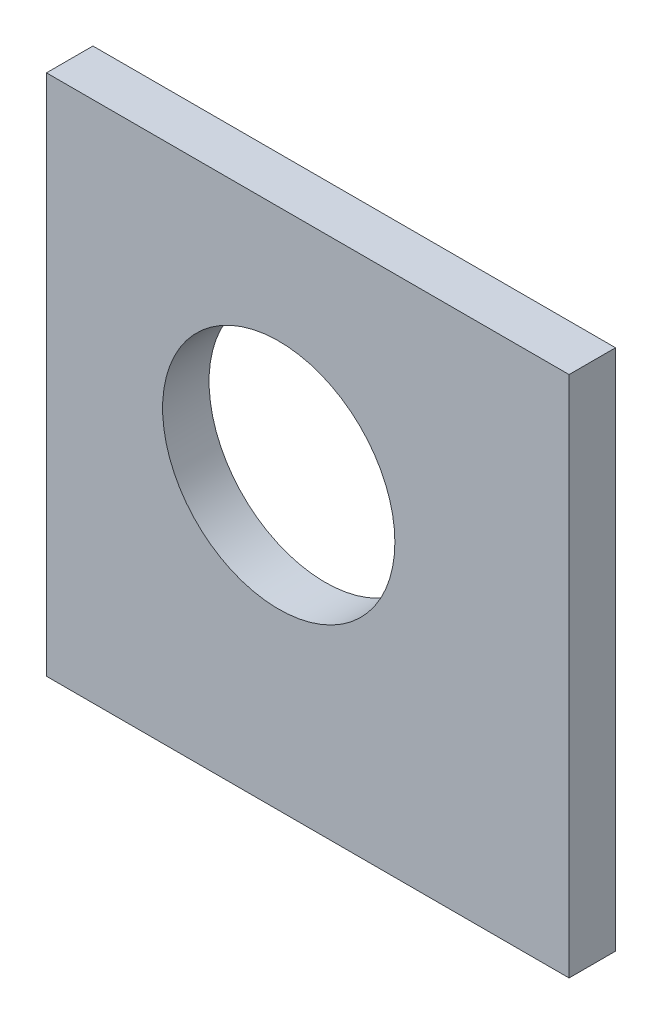
from build123d import *

# Parameters (mm, degrees)
SKETCH1_W           = 22.5
SKETCH1_H           = 22.5
SKETCH1_R           = 5
BOSS_EXTRUDE1_DEPTH = 2


with BuildPart() as part:
    # Sketch1 → Boss-Extrude1 (new body)
    with BuildSketch(Plane.XY):
        with Locations((0.063559322, -4.187853107)):
            Rectangle(SKETCH1_W, SKETCH1_H)
        with Locations((-1.186440678, -2.937853107)):
            Circle(SKETCH1_R, mode=Mode.SUBTRACT)
    extrude(amount=BOSS_EXTRUDE1_DEPTH)


solid = part.part
